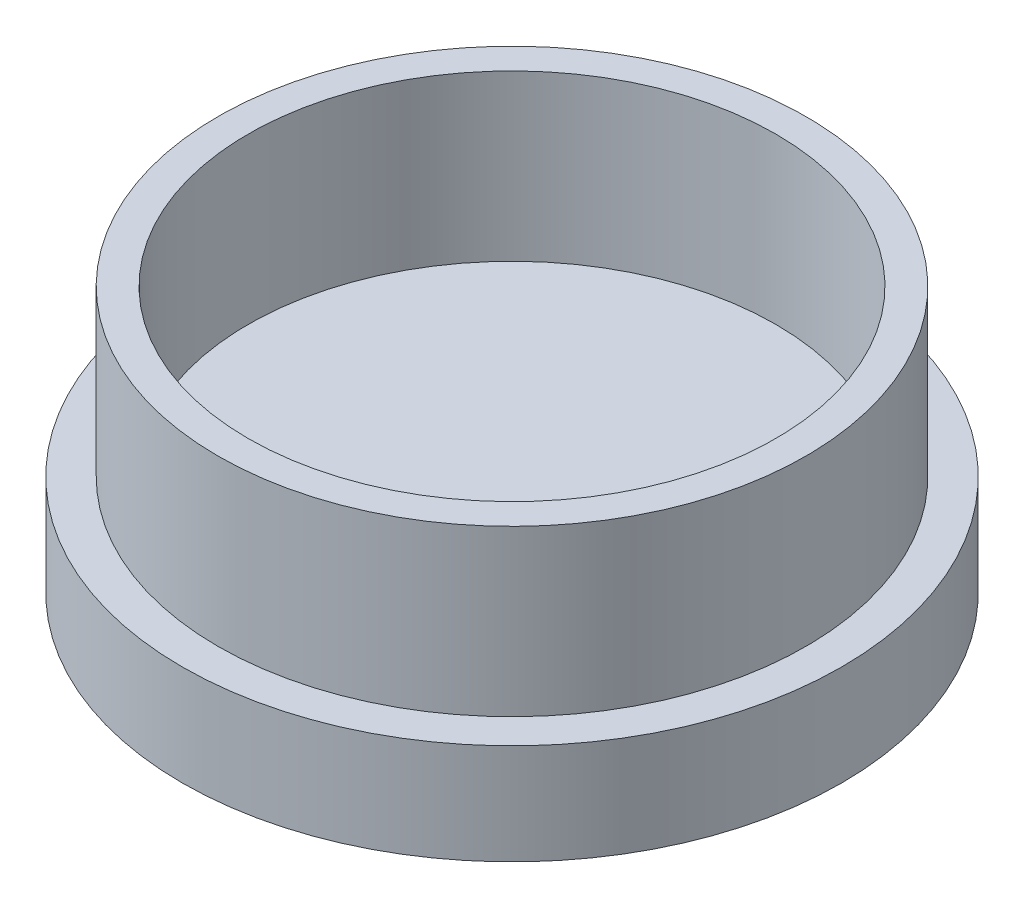
from build123d import *

# Parameters (mm, degrees)
SKETCH2_R           = 500
BOSS_EXTRUDE1_DEPTH = 152.4
SKETCH3_R           = 445.916770951
SKETCH3_R_2         = 400
BOSS_EXTRUDE2_DEPTH = 250


with BuildPart() as part:
    # Sketch2 → Boss-Extrude1 (new body)
    with BuildSketch(Plane(origin=(0, 0, 0), x_dir=(1, 0, 0), z_dir=(0, 1, 0))):
        with Locations(Location((0, 0, 0), (0, 0, 90))):
            Circle(SKETCH2_R)
    extrude(amount=BOSS_EXTRUDE1_DEPTH)

    # Sketch3 → Boss-Extrude2 (add)
    with BuildSketch(Plane(origin=(0, 152.4, 0), x_dir=(1, 0, 0), z_dir=(0, 1, 0))):
        with Locations(Location((0, 0, 0), (0, 0, 270))):
            Circle(SKETCH3_R)
        with Locations(Location((0, 0, 0), (0, 0, 270))):
            Circle(SKETCH3_R_2, mode=Mode.SUBTRACT)
    extrude(amount=BOSS_EXTRUDE2_DEPTH)


solid = part.part
